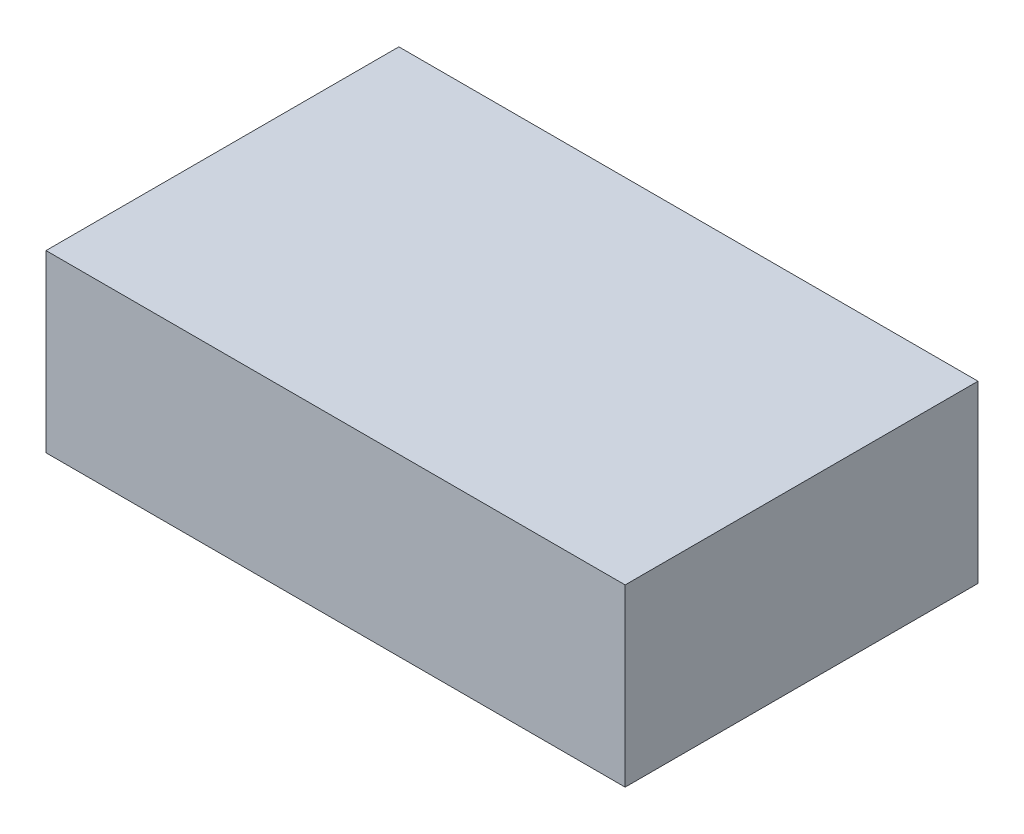
from build123d import *

# Parameters (mm, degrees)
SKETCH1_W           = 83.979825878
SKETCH1_H           = 51.168035986
BOSS_EXTRUDE1_DEPTH = 25.4


with BuildPart() as part:
    # Sketch1 → Boss-Extrude1 (new body)
    with BuildSketch(Plane(origin=(0, 0, 0), x_dir=(1, 0, 0), z_dir=(0, 1, 0))):
        Rectangle(SKETCH1_W, SKETCH1_H)
    extrude(amount=BOSS_EXTRUDE1_DEPTH)


solid = part.part
